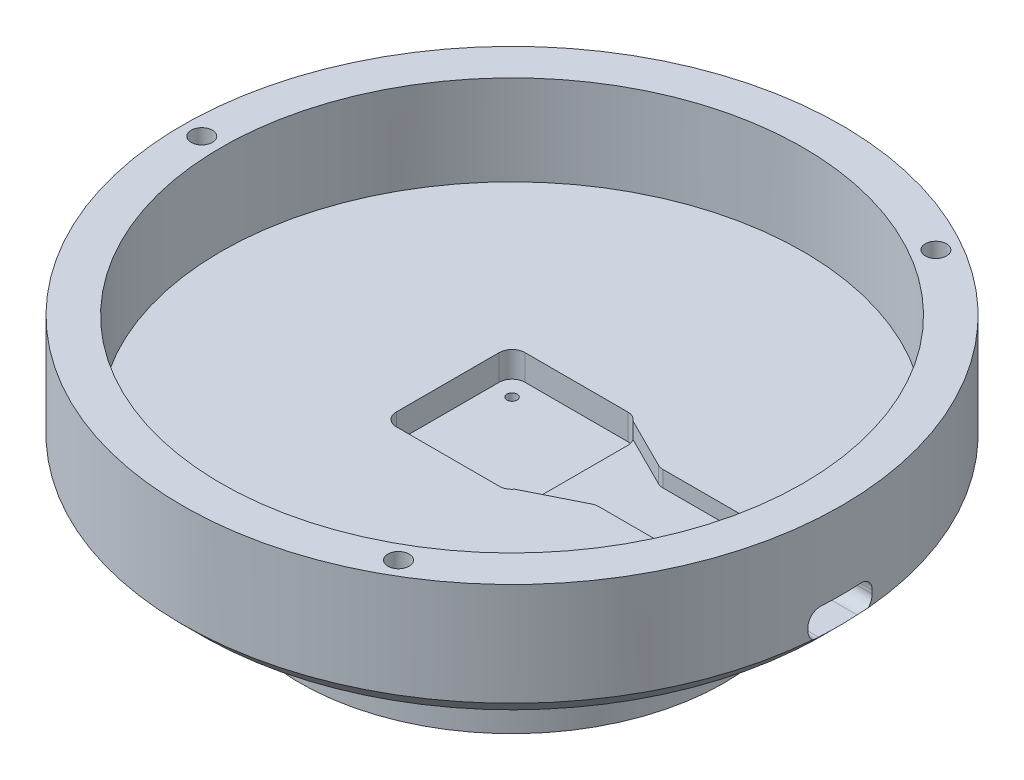
from build123d import *

# Parameters (mm, degrees)
TROU_POUR_TARAUDAGE_POUR_TROU_TARAUD_M4_D     = 3.3
TROU_POUR_TARAUDAGE_POUR_TROU_TARAUD_M4_DEPTH = 10
CHANFREIN1_SIZE                               = 3
ENL_V_MAT_EXTRU_1_DEPTH                       = 4
ENL_V_START                                   = -2.5
ENL_V_MAT_EXTRU_2_DEPTH                       = 2.5
TROU_POUR_TARAUDAGE_POUR_TROU_TARAUD_M2_D     = 1.6
ENL_V_MAT_EXTRU_3_REACH                       = 121.255


with BuildPart() as part:
    # Esquisse1 → Révolution1 (revolve)
    with BuildSketch(Plane.XY):
        Polygon((0, 11.5), (31, 11.5), (31, 0), (33, 0), (33, 14), (51.25, 14), (51.25, 33), (45.25, 33), (45.25, 19), (0, 19), align=None)
    revolve(axis=Axis((0, 0, 0), (0, 1, 0)))

    # Trou pour taraudage pour trou taraudé M41
    with Locations(Plane(origin=(0, 33, 0), x_dir=(1, 0, 0), z_dir=(0, 1, 0))):
        with Locations((-48.25, 0), (24.125, 41.785725733), (24.125, -41.785725733)):
            Hole(TROU_POUR_TARAUDAGE_POUR_TROU_TARAUD_M4_D / 2, depth=TROU_POUR_TARAUDAGE_POUR_TROU_TARAUD_M4_DEPTH)

    # Chanfrein1
    chanfrein1_edges = [part.edges().sort_by_distance(p)[0] for p in [
        (-51.25, 14, 0),
    ]]
    chamfer(chanfrein1_edges, length=CHANFREIN1_SIZE)

    # Esquisse4 → Enlèv. mat.-Extru.1 (cut)
    with BuildSketch(Plane(origin=(0, 19, 0), x_dir=(1, 0, 0), z_dir=(0, 1, 0))):
        with BuildLine():
            Line((-8, 10), (8, 10))
            ThreePointArc((8, 10), (9.414213562, 9.414213562), (10, 8))
            Line((10, 8), (10, -8))
            ThreePointArc((10, -8), (9.414213562, -9.414213562), (8, -10))
            Line((8, -10), (-8, -10))
            ThreePointArc((-8, -10), (-9.414213562, -9.414213562), (-10, -8))
            Line((-10, -8), (-10, 8))
            ThreePointArc((-10, 8), (-9.414213562, 9.414213562), (-8, 10))
        make_face()
    extrude(amount=-ENL_V_MAT_EXTRU_1_DEPTH, mode=Mode.SUBTRACT)

    # Esquisse5 → Enlèv. mat.-Extru.2 (cut)
    with BuildSketch(Plane(origin=(0, 19, 0), x_dir=(1, 0, 0), z_dir=(0, 1, 0)).offset(ENL_V_START)):
        with BuildLine():
            Line((8, -10), (17.577708764, -5.211145618))
            ThreePointArc((17.577708764, -5.211145618), (18.012630114, -5.053502021), (18.472135955, -5))
            Line((18.472135955, -5), (43.145828304, -5))
            ThreePointArc((43.145828304, -5), (44.510112613, -4.462439169), (45.141011115, -3.138728324))
            ThreePointArc((45.141011115, -3.138728324), (45.25, 0), (45.141011115, 3.138728324))
            ThreePointArc((45.141011115, 3.138728324), (44.510112613, 4.462439169), (43.145828304, 5))
            Line((43.145828304, 5), (18.472135955, 5))
            ThreePointArc((18.472135955, 5), (18.012630114, 5.053502021), (17.577708764, 5.211145618))
            Line((17.577708764, 5.211145618), (8, 10))
            Line((8, 10), (8, -10))
        make_face()
    extrude(amount=ENL_V_MAT_EXTRU_2_DEPTH, mode=Mode.SUBTRACT)

    # Trou pour taraudage pour trou taraudé M21 (through all)
    with Locations(Plane(origin=(0, 15, 0), x_dir=(1, 0, 0), z_dir=(0, 1, 0))):
        with Locations((-7, 7), (-7, -7)):
            Hole(TROU_POUR_TARAUDAGE_POUR_TROU_TARAUD_M2_D / 2)

    # Esquisse8 → Enlèv. mat.-Extru.3 (cut, up to next)
    with BuildSketch(Plane(origin=(51.25, 0, 0), x_dir=(0, 0, -1), z_dir=(1, 0, 0)), mode=Mode.PRIVATE) as enl_v_mat_extru_3_sk1:
        with BuildLine():
            Line((-3, 21), (3, 21))
            ThreePointArc((3, 21), (4.414213562, 20.414213562), (5, 19))
            Line((5, 19), (5, 18.5))
            ThreePointArc((5, 18.5), (4.414213562, 17.085786438), (3, 16.5))
            Line((3, 16.5), (-3, 16.5))
            ThreePointArc((-3, 16.5), (-4.414213562, 17.085786438), (-5, 18.5))
            Line((-5, 18.5), (-5, 19))
            ThreePointArc((-5, 19), (-4.414213562, 20.414213562), (-3, 21))
        make_face()
    enl_v_mat_extru_3_tool1 = extrude(enl_v_mat_extru_3_sk1.sketch, amount=-ENL_V_MAT_EXTRU_3_REACH, mode=Mode.PRIVATE) & part.part
    add(enl_v_mat_extru_3_tool1.solids().sort_by_distance((51.25, 18.75, 0))[0], mode=Mode.SUBTRACT)


solid = part.part
